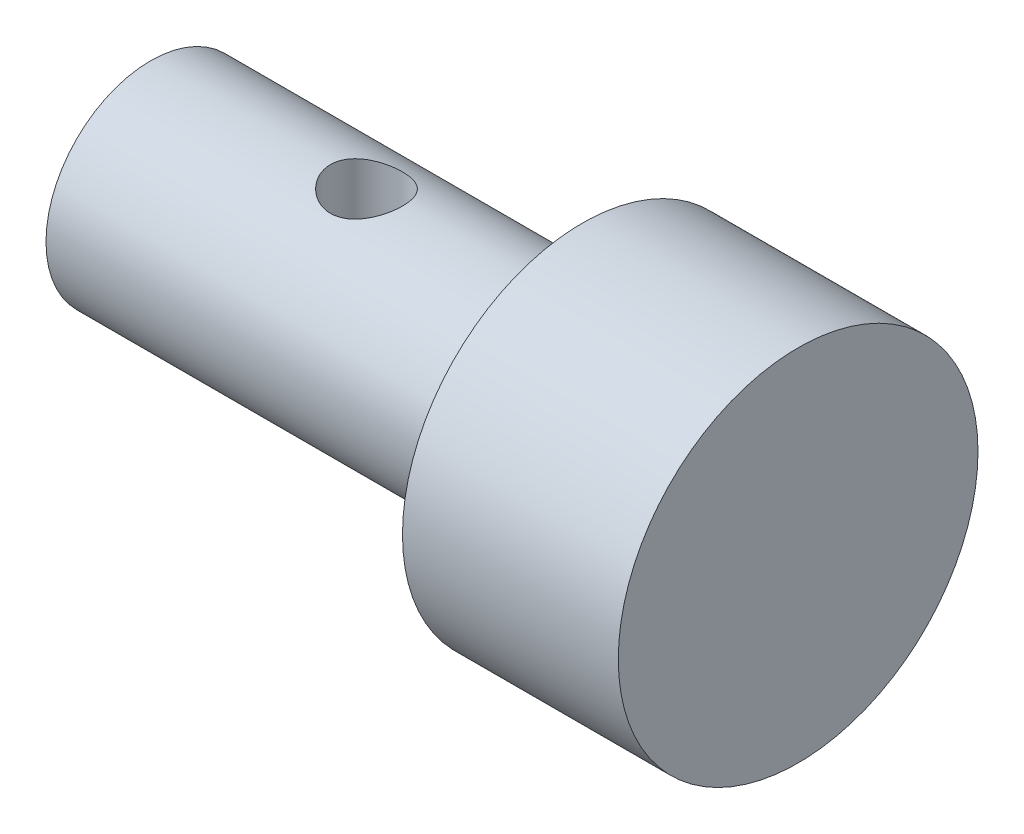
from build123d import *

# Parameters (mm, degrees)
SKETCH2_R               = 1.455
BOSS_EXTRUDE3_DEPTH     = 6
SKETCH3_R               = 2.5
BOSS_EXTRUDE4_DEPTH     = 3
CUT_EXTRUDE1_DEPTH      = 10.669539803
CUT_EXTRUDE1_DEPTH_BACK = 10.669539803
SKETCH4_R               = 0.5


with BuildPart() as part:
    # Sketch2 → Boss-Extrude3 (new body)
    with BuildSketch(Plane(origin=(0, 0, 0), x_dir=(0, 0, -1), z_dir=(1, 0, 0))):
        Circle(SKETCH2_R)
    extrude(amount=BOSS_EXTRUDE3_DEPTH)

    # Sketch3 → Boss-Extrude4 (add)
    with BuildSketch(Plane(origin=(6, 0, 0), x_dir=(0, 0, -1), z_dir=(1, 0, 0))):
        Circle(SKETCH3_R)
    extrude(amount=BOSS_EXTRUDE4_DEPTH)

    # Sketch4 → Cut-Extrude1 (cut, two sides: drawn at the far end of the back side and taken through both)
    with BuildSketch(Plane(origin=(0, 0, 0), x_dir=(1, 0, 0), z_dir=(0, 1, 0)).offset(-CUT_EXTRUDE1_DEPTH_BACK)):
        with Locations(Location((3, 0, 0), (0, 0, 270))):
            Circle(SKETCH4_R)
    extrude(amount=CUT_EXTRUDE1_DEPTH + CUT_EXTRUDE1_DEPTH_BACK, mode=Mode.SUBTRACT)


solid = part.part
